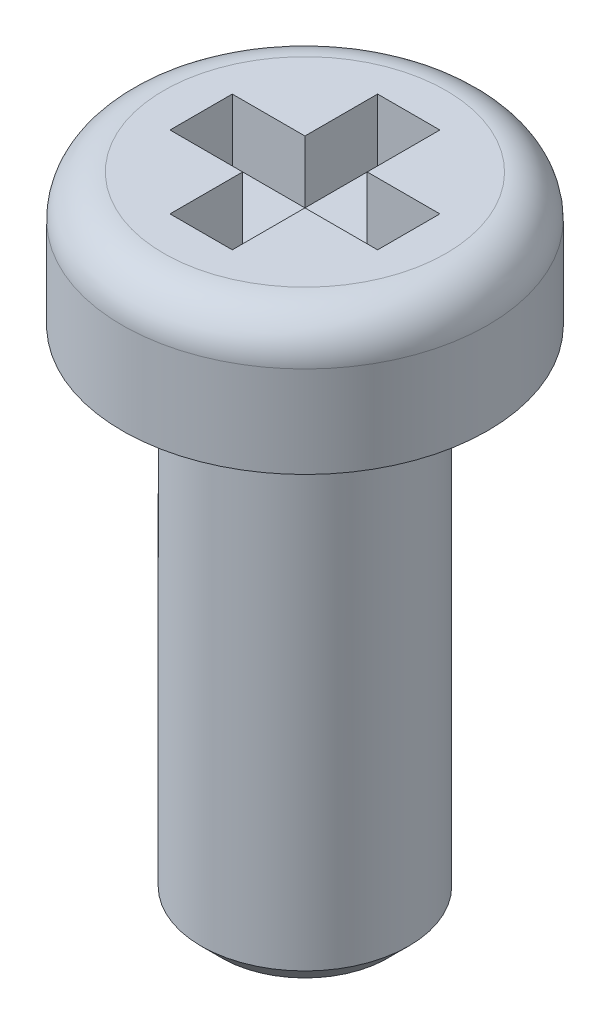
from build123d import *

# Parameters (mm, degrees)
CHAMFER1_SIZE      = 0.25
FILLET1_R          = 0.5
CUT_EXTRUDE1_DEPTH = 0.75


with BuildPart() as part:
    # Sketch1 → Revolve1 (revolve)
    with BuildSketch(Plane.XY, mode=Mode.PRIVATE) as revolve1_sk:
        Polygon((0, 0), (-2.2, 0), (-2.2, -1.6), (-1.25, -1.6), (-1.25, -7.7), (0, -7.7), align=None)
    revolve(revolve1_sk.sketch.rotate(Axis((0, -138.087166902, 0), (0, 1, 0)), 180), axis=Axis((0, -138.087166902, 0), (0, 1, 0)))

    # Chamfer1
    chamfer1_edges = [part.edges().sort_by_distance(p)[0] for p in [
        (-1.25, -7.7, 0),
    ]]
    chamfer(chamfer1_edges, length=CHAMFER1_SIZE)

    # Fillet1
    fillet1_edges = [part.edges().sort_by_distance(p)[0] for p in [
        (-2.2, 0, 0),
    ]]
    fillet(fillet1_edges, radius=FILLET1_R)

    # Sketch2 → Cut-Extrude1 (cut)
    with BuildSketch(Plane(origin=(0, 0, 0), x_dir=(1, 0, 0), z_dir=(0, 1, 0))):
        Polygon((-0.375, 0.375), (-0.375, 1.25), (0.375, 1.25), (0.375, 0.375), (1.25, 0.375), (1.25, -0.375), (0.375, -0.375), (0.375, -1.25), (-0.375, -1.25), (-0.375, -0.375), (-1.25, -0.375), (-1.25, 0.375), align=None)
    extrude(amount=-CUT_EXTRUDE1_DEPTH, mode=Mode.SUBTRACT)


solid = part.part
